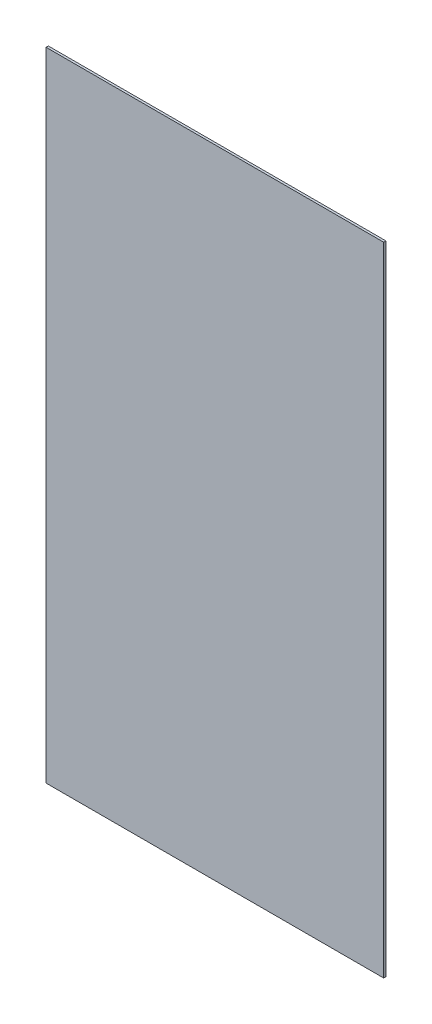
from build123d import *

# Parameters (mm, degrees)
SKETCH1_W           = 179
SKETCH1_H           = 338
BOSS_EXTRUDE1_DEPTH = 1.2


with BuildPart() as part:
    # Sketch1 → Boss-Extrude1 (new body)
    with BuildSketch(Plane.XY):
        with Locations((0, -159.5)):
            Rectangle(SKETCH1_W, SKETCH1_H)
    extrude(amount=BOSS_EXTRUDE1_DEPTH)


solid = part.part
